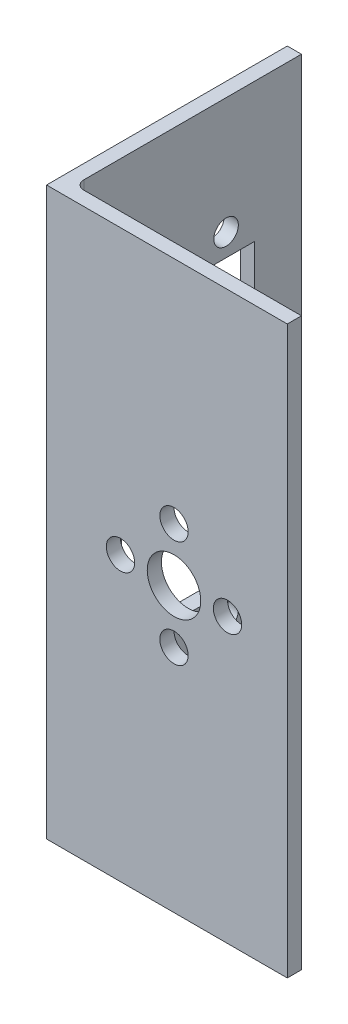
from build123d import *

# Parameters (mm, degrees)
BOSS_EXTRUDE1_DEPTH = 127
CUT_EXTRUDE1_REACH  = 147.912
SKETCH2_R           = 6
SKETCH2_R_2         = 3.175
CUT_EXTRUDE2_REACH  = 147.912
SKETCH3_R           = 2.75
SKETCH3_W           = 29.8
SKETCH3_H           = 64.8
FILLET1_R           = 2


with BuildPart() as part:
    # Sketch1 → Boss-Extrude1 (new body)
    with BuildSketch(Plane(origin=(0, 0, 0), x_dir=(1, 0, 0), z_dir=(0, 1, 0))):
        Polygon((0, 50.8), (0, 0), (50.8, 0), (50.8, -3.175), (-3.175, -3.175), (-3.175, 50.8), align=None)
    extrude(amount=BOSS_EXTRUDE1_DEPTH)

    # Sketch2 → Cut-Extrude1 (cut, up to next)
    with BuildSketch(Plane(origin=(0, 0, 0), x_dir=(-1, 0, 0), z_dir=(0, 0, -1)), mode=Mode.PRIVATE) as cut_extrude1_sk1:
        with Locations((-25.4, 63.5)):
            Circle(SKETCH2_R)
    cut_extrude1_tool1 = extrude(cut_extrude1_sk1.sketch, amount=-CUT_EXTRUDE1_REACH, mode=Mode.PRIVATE) & part.part
    # Sketch2 → Cut-Extrude1 (cut, up to next)
    with BuildSketch(Plane(origin=(0, 0, 0), x_dir=(-1, 0, 0), z_dir=(0, 0, -1)), mode=Mode.PRIVATE) as cut_extrude1_sk2:
        with Locations((-25.4, 75.5)):
            Circle(SKETCH2_R_2)
    cut_extrude1_tool2 = extrude(cut_extrude1_sk2.sketch, amount=-CUT_EXTRUDE1_REACH, mode=Mode.PRIVATE) & part.part
    # Sketch2 → Cut-Extrude1 (cut, up to next)
    with BuildSketch(Plane(origin=(0, 0, 0), x_dir=(-1, 0, 0), z_dir=(0, 0, -1)), mode=Mode.PRIVATE) as cut_extrude1_sk3:
        with Locations((-13.4, 63.5)):
            Circle(SKETCH2_R_2)
    cut_extrude1_tool3 = extrude(cut_extrude1_sk3.sketch, amount=-CUT_EXTRUDE1_REACH, mode=Mode.PRIVATE) & part.part
    # Sketch2 → Cut-Extrude1 (cut, up to next)
    with BuildSketch(Plane(origin=(0, 0, 0), x_dir=(-1, 0, 0), z_dir=(0, 0, -1)), mode=Mode.PRIVATE) as cut_extrude1_sk4:
        with Locations((-25.4, 51.5)):
            Circle(SKETCH2_R_2)
    cut_extrude1_tool4 = extrude(cut_extrude1_sk4.sketch, amount=-CUT_EXTRUDE1_REACH, mode=Mode.PRIVATE) & part.part
    # Sketch2 → Cut-Extrude1 (cut, up to next)
    with BuildSketch(Plane(origin=(0, 0, 0), x_dir=(-1, 0, 0), z_dir=(0, 0, -1)), mode=Mode.PRIVATE) as cut_extrude1_sk5:
        with Locations((-37.4, 63.5)):
            Circle(SKETCH2_R_2)
    cut_extrude1_tool5 = extrude(cut_extrude1_sk5.sketch, amount=-CUT_EXTRUDE1_REACH, mode=Mode.PRIVATE) & part.part
    add(cut_extrude1_tool1.solids().sort_by_distance((25.4, 63.5, 0))[0], mode=Mode.SUBTRACT)
    add(cut_extrude1_tool2.solids().sort_by_distance((25.4, 75.5, 0))[0], mode=Mode.SUBTRACT)
    add(cut_extrude1_tool3.solids().sort_by_distance((13.4, 63.5, 0))[0], mode=Mode.SUBTRACT)
    add(cut_extrude1_tool4.solids().sort_by_distance((25.4, 51.5, 0))[0], mode=Mode.SUBTRACT)
    add(cut_extrude1_tool5.solids().sort_by_distance((37.4, 63.5, 0))[0], mode=Mode.SUBTRACT)

    # Sketch3 → Cut-Extrude2 (cut, up to next)
    with BuildSketch(Plane(origin=(0, 0, 0), x_dir=(0, 0, -1), z_dir=(1, 0, 0)), mode=Mode.PRIVATE) as cut_extrude2_sk1:
        with Locations((33.9, 100.9)):
            Circle(SKETCH3_R)
    cut_extrude2_tool1 = extrude(cut_extrude2_sk1.sketch, amount=-CUT_EXTRUDE2_REACH, mode=Mode.PRIVATE) & part.part
    # Sketch3 → Cut-Extrude2 (cut, up to next)
    with BuildSketch(Plane(origin=(0, 0, 0), x_dir=(0, 0, -1), z_dir=(1, 0, 0)), mode=Mode.PRIVATE) as cut_extrude2_sk2:
        with Locations((16.9, 100.9)):
            Circle(SKETCH3_R)
    cut_extrude2_tool2 = extrude(cut_extrude2_sk2.sketch, amount=-CUT_EXTRUDE2_REACH, mode=Mode.PRIVATE) & part.part
    # Sketch3 → Cut-Extrude2 (cut, up to next)
    with BuildSketch(Plane(origin=(0, 0, 0), x_dir=(0, 0, -1), z_dir=(1, 0, 0)), mode=Mode.PRIVATE) as cut_extrude2_sk3:
        with Locations((16.9, 26.1)):
            Circle(SKETCH3_R)
    cut_extrude2_tool3 = extrude(cut_extrude2_sk3.sketch, amount=-CUT_EXTRUDE2_REACH, mode=Mode.PRIVATE) & part.part
    # Sketch3 → Cut-Extrude2 (cut, up to next)
    with BuildSketch(Plane(origin=(0, 0, 0), x_dir=(0, 0, -1), z_dir=(1, 0, 0)), mode=Mode.PRIVATE) as cut_extrude2_sk4:
        with Locations((33.9, 26.1)):
            Circle(SKETCH3_R)
    cut_extrude2_tool4 = extrude(cut_extrude2_sk4.sketch, amount=-CUT_EXTRUDE2_REACH, mode=Mode.PRIVATE) & part.part
    # Sketch3 → Cut-Extrude2 (cut, up to next)
    with BuildSketch(Plane(origin=(0, 0, 0), x_dir=(0, 0, -1), z_dir=(1, 0, 0)), mode=Mode.PRIVATE) as cut_extrude2_sk5:
        with Locations((25.4, 63.5)):
            Rectangle(SKETCH3_W, SKETCH3_H)
    cut_extrude2_tool5 = extrude(cut_extrude2_sk5.sketch, amount=-CUT_EXTRUDE2_REACH, mode=Mode.PRIVATE) & part.part
    add(cut_extrude2_tool1.solids().sort_by_distance((0, 100.9, -33.9))[0], mode=Mode.SUBTRACT)
    add(cut_extrude2_tool2.solids().sort_by_distance((0, 100.9, -16.9))[0], mode=Mode.SUBTRACT)
    add(cut_extrude2_tool3.solids().sort_by_distance((0, 26.1, -16.9))[0], mode=Mode.SUBTRACT)
    add(cut_extrude2_tool4.solids().sort_by_distance((0, 26.1, -33.9))[0], mode=Mode.SUBTRACT)
    add(cut_extrude2_tool5.solids().sort_by_distance((0, 63.5, -25.4))[0], mode=Mode.SUBTRACT)

    # Fillet1
    fillet1_edges = [part.edges().sort_by_distance(p)[0] for p in [
        (0, 63.5, 0),
    ]]
    fillet(fillet1_edges, radius=FILLET1_R)


solid = part.part
